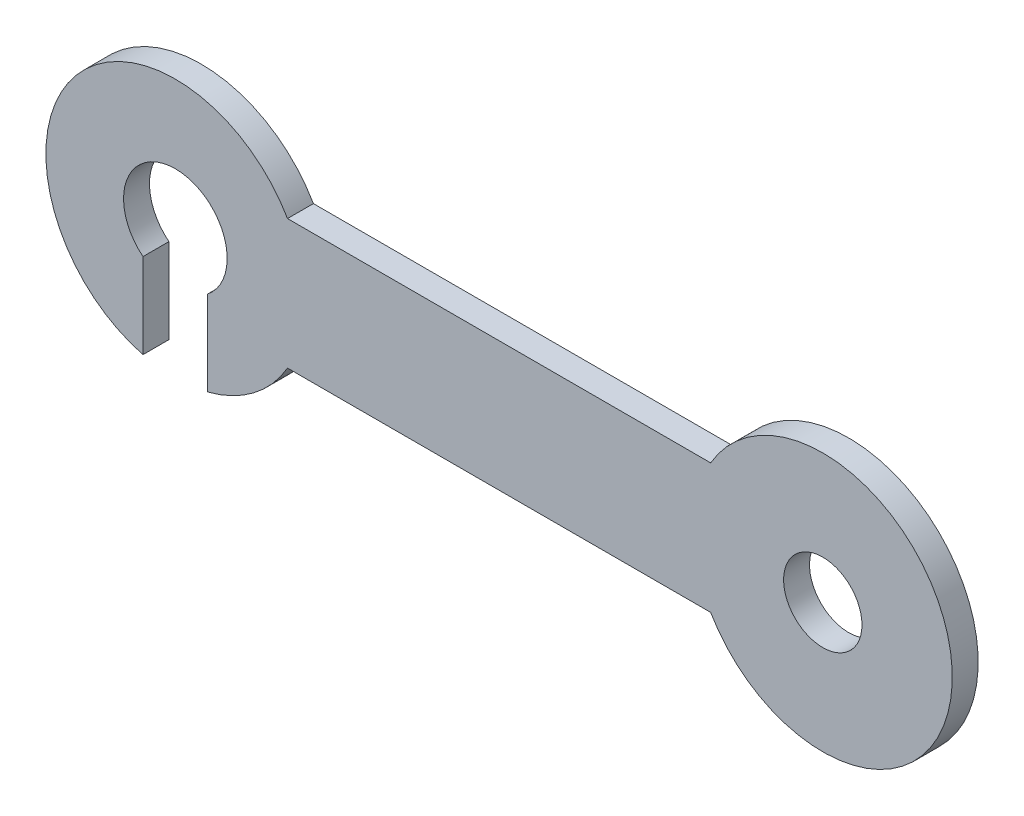
from build123d import *

# Parameters (mm, degrees)
SKETCH1_R           = 20
BOSS_EXTRUDE1_DEPTH = 4
BOSS_EXTRUDE2_DEPTH = 4
SKETCH4_R           = 8
CUT_EXTRUDE1_DEPTH  = 4
SKETCH5_W           = 10
SKETCH5_H           = 19.132811744
CUT_EXTRUDE3_DEPTH  = 4
SKETCH6_R           = 6.05
CUT_EXTRUDE4_DEPTH  = 4


with BuildPart() as part:
    # Sketch1 → Boss-Extrude1 (new body)
    with BuildSketch(Plane.XY):
        Circle(SKETCH1_R)
    extrude(amount=BOSS_EXTRUDE1_DEPTH)

    # Sketch3 → Boss-Extrude2 (add)
    with BuildSketch(Plane.XY):
        with BuildLine():
            ThreePointArc((120, 0), (105.176380902, 19.318516526), (82.679491924, 10))
            Line((82.679491924, 10), (100, 10))
            Line((100, 10), (100, 0))
            Line((100, 0), (100, -10))
            Line((100, -10), (82.679491924, -10))
            ThreePointArc((82.679491924, -10), (105.176380902, -19.318516526), (120, 0))
        make_face()
        with BuildLine():
            Line((100, 10), (82.679491924, 10))
            ThreePointArc((82.679491924, 10), (80, 0), (82.679491924, -10))
            Line((82.679491924, -10), (100, -10))
            Line((100, -10), (100, 0))
            Line((100, 0), (100, 10))
        make_face()
        with BuildLine():
            Line((82.679491924, 10), (0, 10))
            Line((0, 10), (0, 0))
            Line((0, 0), (0, -10))
            Line((0, -10), (82.679491924, -10))
            ThreePointArc((82.679491924, -10), (80, 0), (82.679491924, 10))
        make_face()
    extrude(amount=BOSS_EXTRUDE2_DEPTH)

    # Sketch4 → Cut-Extrude1 (cut)
    with BuildSketch(Plane.XY):
        Circle(SKETCH4_R)
    extrude(amount=CUT_EXTRUDE1_DEPTH, mode=Mode.SUBTRACT)

    # Sketch5 → Cut-Extrude3 (cut)
    with BuildSketch(Plane.XY):
        with Locations((0, -14.406019059)):
            Rectangle(SKETCH5_W, SKETCH5_H)
    extrude(amount=CUT_EXTRUDE3_DEPTH, mode=Mode.SUBTRACT)

    # Sketch6 → Cut-Extrude4 (cut)
    with BuildSketch(Plane.XY):
        with Locations((100, 0)):
            Circle(SKETCH6_R)
    extrude(amount=CUT_EXTRUDE4_DEPTH, mode=Mode.SUBTRACT)


solid = part.part
